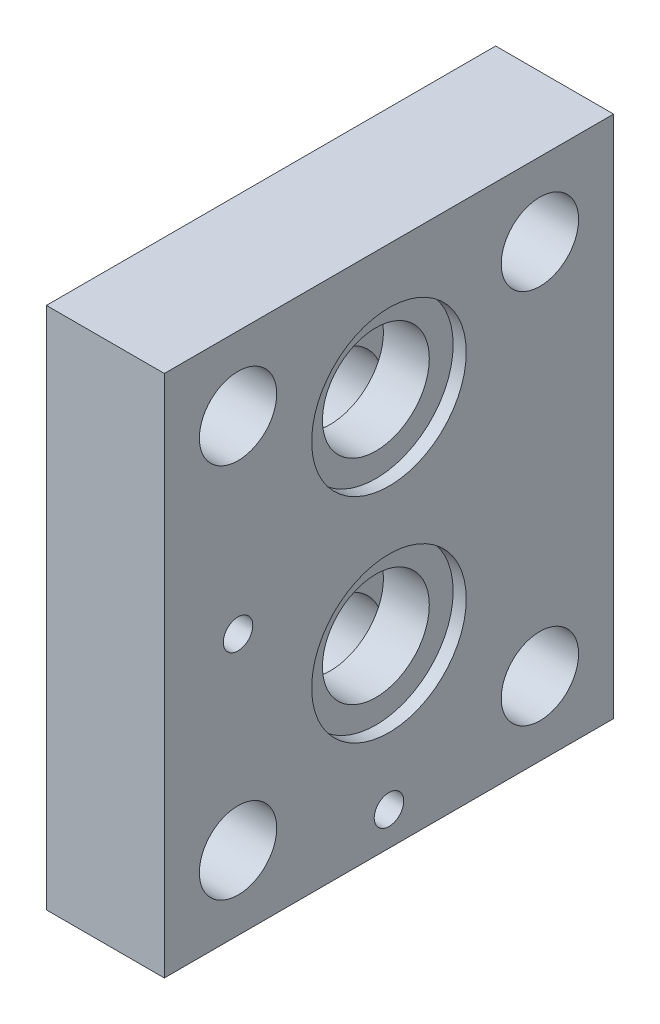
from build123d import *

# Parameters (mm, degrees)
SKETCH1_W           = 112.776
SKETCH1_H           = 96.774
BOSS_EXTRUDE1_DEPTH = 25.4
SKETCH2_R           = 8.334375
CUT_EXTRUDE2_DEPTH  = 151.760715215
SKETCH3_R           = 8.334375
CUT_EXTRUDE4_DEPTH  = 151.760715215
SKETCH4_R           = 11.509375
CUT_EXTRUDE6_DEPTH  = 12.7
SKETCH5_R           = 11.509375
CUT_EXTRUDE8_DEPTH  = 12.7
CUT_EXTRUDE10_START = 25.4
SKETCH6_R           = 11.509375
CUT_EXTRUDE10_DEPTH = 12.7
CUT_EXTRUDE12_START = 25.4
SKETCH7_R           = 11.509375
CUT_EXTRUDE12_DEPTH = 12.7
CUT_EXTRUDE14_START = 25.4
SKETCH8_R           = 16.6497
CUT_EXTRUDE14_DEPTH = 2.8194
CUT_EXTRUDE16_START = 25.4
SKETCH9_R           = 16.6497
CUT_EXTRUDE16_DEPTH = 2.8194
SKETCH10_R          = 3.571875
CUT_EXTRUDE18_DEPTH = 7.874
SKETCH11_R          = 3.571875
CUT_EXTRUDE20_DEPTH = 7.874
CUT_EXTRUDE22_START = 25.4
SKETCH12_R          = 3.175
CUT_EXTRUDE22_DEPTH = 7.874
CUT_EXTRUDE24_START = 25.4
SKETCH13_R          = 3.175
CUT_EXTRUDE24_DEPTH = 7.874


with BuildPart() as part:
    # Sketch1 → Boss-Extrude1 (new body)
    with BuildSketch(Plane.YZ):
        with Locations((56.388, 48.387)):
            Rectangle(SKETCH1_W, SKETCH1_H)
    extrude(amount=BOSS_EXTRUDE1_DEPTH)

    # Sketch2 → Cut-Extrude2 (cut, through all)
    with BuildSketch(Plane.YZ):
        with Locations(Location((15.875, 15.875, 0), (0, 0, 270))):
            Circle(SKETCH2_R)
    extrude(amount=CUT_EXTRUDE2_DEPTH, mode=Mode.SUBTRACT)

    # Sketch3 → Cut-Extrude4 (cut, through all)
    with BuildSketch(Plane.YZ):
        with Locations(Location((96.901, 15.875, 0), (0, 0, 270))):
            Circle(SKETCH3_R)
        with Locations(Location((15.875, 80.899, 0), (0, 0, 270))):
            Circle(SKETCH3_R)
        with Locations(Location((96.901, 80.899, 0), (0, 0, 270))):
            Circle(SKETCH3_R)
    extrude(amount=CUT_EXTRUDE4_DEPTH, mode=Mode.SUBTRACT)

    # Sketch4 → Cut-Extrude6 (cut)
    with BuildSketch(Plane.YZ):
        with Locations(Location((28.575, 48.387, 0), (0, 0, 270))):
            Circle(SKETCH4_R)
    extrude(amount=CUT_EXTRUDE6_DEPTH, mode=Mode.SUBTRACT)

    # Sketch5 → Cut-Extrude8 (cut)
    with BuildSketch(Plane.YZ):
        with Locations(Location((74.549, 48.387, 0), (0, 0, 270))):
            Circle(SKETCH5_R)
    extrude(amount=CUT_EXTRUDE8_DEPTH, mode=Mode.SUBTRACT)

    # Sketch6 → Cut-Extrude10 (cut)
    with BuildSketch(Plane.YZ.offset(CUT_EXTRUDE10_START)):
        with Locations(Location((38.227, 48.387, 0), (0, 0, 270))):
            Circle(SKETCH6_R)
    extrude(amount=-CUT_EXTRUDE10_DEPTH, mode=Mode.SUBTRACT)

    # Sketch7 → Cut-Extrude12 (cut)
    with BuildSketch(Plane.YZ.offset(CUT_EXTRUDE12_START)):
        with Locations(Location((84.201, 48.387, 0), (0, 0, 270))):
            Circle(SKETCH7_R)
    extrude(amount=-CUT_EXTRUDE12_DEPTH, mode=Mode.SUBTRACT)

    # Sketch8 → Cut-Extrude14 (cut)
    with BuildSketch(Plane.YZ.offset(CUT_EXTRUDE14_START)):
        with Locations(Location((38.227, 48.387, 0), (0, 0, 270))):
            Circle(SKETCH8_R)
    extrude(amount=-CUT_EXTRUDE14_DEPTH, mode=Mode.SUBTRACT)

    # Sketch9 → Cut-Extrude16 (cut)
    with BuildSketch(Plane.YZ.offset(CUT_EXTRUDE16_START)):
        with Locations(Location((84.201, 48.387, 0), (0, 0, 270))):
            Circle(SKETCH9_R)
    extrude(amount=-CUT_EXTRUDE16_DEPTH, mode=Mode.SUBTRACT)

    # Sketch10 → Cut-Extrude18 (cut)
    with BuildSketch(Plane.YZ):
        with Locations(Location((105.537, 48.387, 0), (0, 0, 270))):
            Circle(SKETCH10_R)
    extrude(amount=CUT_EXTRUDE18_DEPTH, mode=Mode.SUBTRACT)

    # Sketch11 → Cut-Extrude20 (cut)
    with BuildSketch(Plane.YZ):
        with Locations(Location((56.515, 15.875, 0), (0, 0, 270))):
            Circle(SKETCH11_R)
    extrude(amount=CUT_EXTRUDE20_DEPTH, mode=Mode.SUBTRACT)

    # Sketch12 → Cut-Extrude22 (cut)
    with BuildSketch(Plane.YZ.offset(CUT_EXTRUDE22_START)):
        with Locations(Location((7.239, 48.387, 0), (0, 0, 270))):
            Circle(SKETCH12_R)
    extrude(amount=-CUT_EXTRUDE22_DEPTH, mode=Mode.SUBTRACT)

    # Sketch13 → Cut-Extrude24 (cut)
    with BuildSketch(Plane.YZ.offset(CUT_EXTRUDE24_START)):
        with Locations(Location((56.261, 80.899, 0), (0, 0, 270))):
            Circle(SKETCH13_R)
    extrude(amount=-CUT_EXTRUDE24_DEPTH, mode=Mode.SUBTRACT)


solid = part.part
